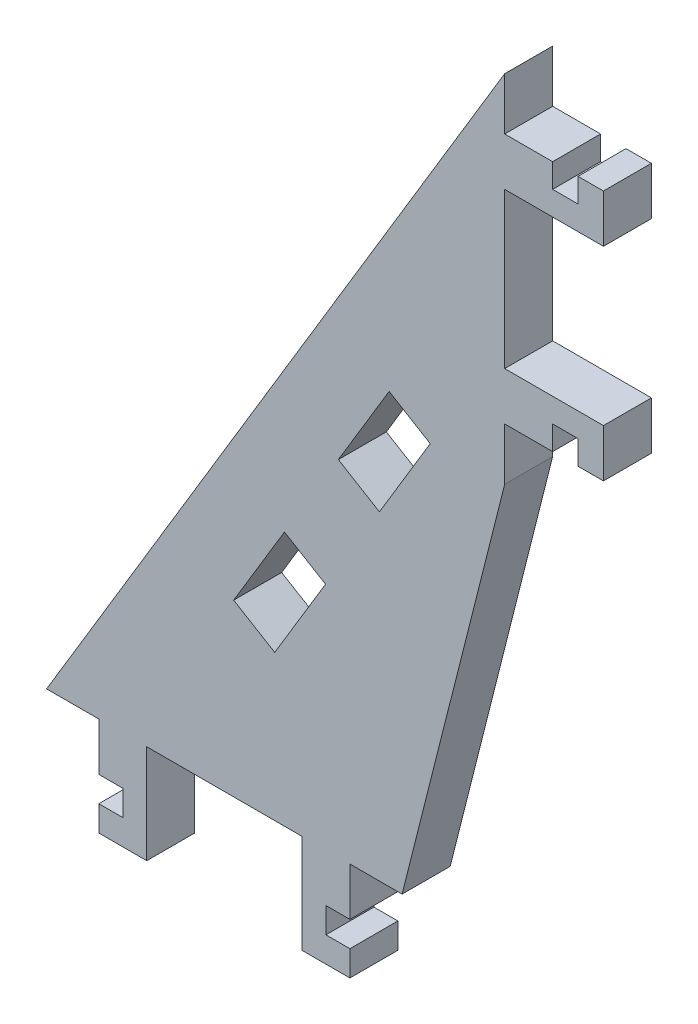
from build123d import *

# Parameters (mm, degrees)
BOSS_EXTRUDE1_DEPTH = 6
CUT_EXTRUDE1_DEPTH  = 73.882968029


with BuildPart() as part:
    # Sketch1 → Boss-Extrude1 (new body)
    with BuildSketch(Plane.XY):
        Polygon((28.6385, 47.625), (28.6385, 41.0972), (34.6329, 41.0972), (34.6329, 38.1), (37.8079, 38.1), (37.8079, 41.0972), (40.9829, 41.0972), (40.9829, 35.1028), (28.6385, 35.1028), (28.6385, 15.6972), (40.9829, 15.6972), (40.9829, 9.7028), (37.8079, 9.7028), (37.8079, 12.7), (34.6329, 12.7), (34.6329, 9.7028), (28.6385, 9.7028), (28.6385, 3.175), (15.8115, -47.625), (9.2837, -47.625), (9.2837, -53.6194), (6.2865, -53.6194), (6.2865, -56.7944), (9.2837, -56.7944), (9.2837, -59.9694), (3.2893, -59.9694), (3.2893, -47.625), (-16.1163, -47.625), (-16.1163, -59.9694), (-22.1107, -59.9694), (-22.1107, -56.7944), (-19.1135, -56.7944), (-19.1135, -53.6194), (-22.1107, -53.6194), (-22.1107, -47.625), (-28.6385, -47.625), align=None)
    extrude(amount=BOSS_EXTRUDE1_DEPTH)

    # Sketch2 → Cut-Extrude1 (cut, through all)
    with BuildSketch(Plane.XY.offset(6)):
        Polygon((14.189592964, 6.000975012), (7.84117256, -4.556265128), (12.978303844, -7.645393407), (19.326724249, 2.911846732), align=None)
        Polygon((1.100066357, -15.766530432), (6.237197642, -18.855658711), (-0.111222762, -29.412898851), (-5.248354047, -26.323770571), align=None)
    extrude(amount=-CUT_EXTRUDE1_DEPTH, mode=Mode.SUBTRACT)


solid = part.part
